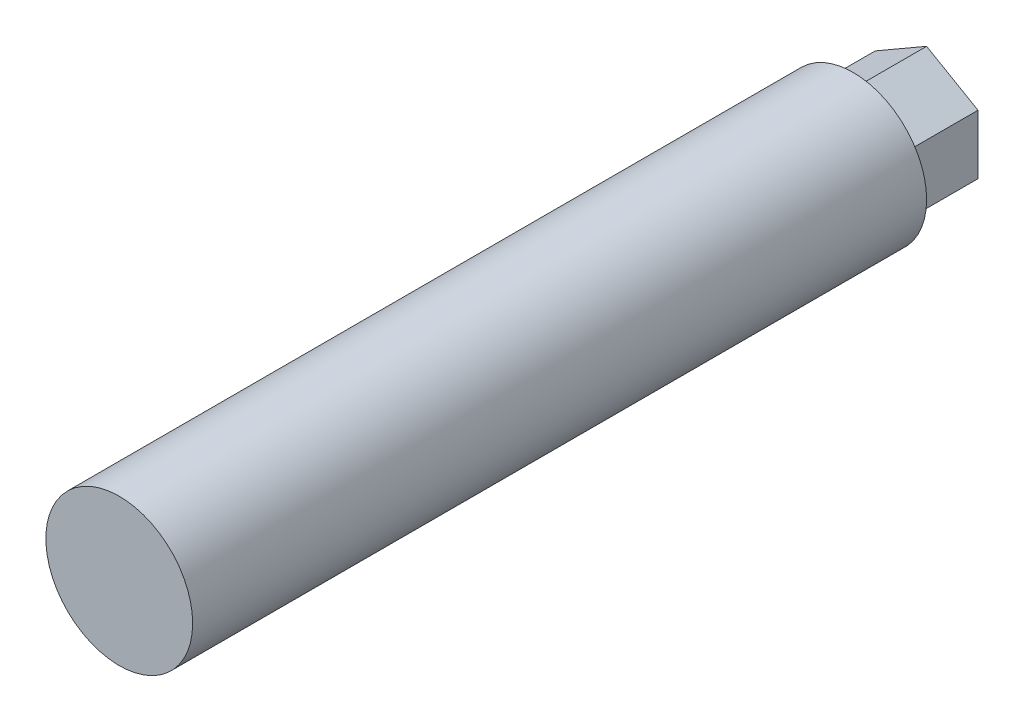
from build123d import *

# Parameters (mm, degrees)
SKETCH1_R           = 5
BOSS_EXTRUDE1_DEPTH = 50
BOSS_EXTRUDE2_DEPTH = 5


with BuildPart() as part:
    # Sketch1 → Boss-Extrude1 (new body)
    with BuildSketch(Plane.XY):
        Circle(SKETCH1_R)
    extrude(amount=BOSS_EXTRUDE1_DEPTH)

    # Sketch2 → Boss-Extrude2 (add)
    with BuildSketch(Plane(origin=(0, 0, 0), x_dir=(-1, 0, 0), z_dir=(0, 0, -1))):
        Polygon((0, 4.041451884), (-3.5, 2.020725942), (-3.5, -2.020725942), (0, -4.041451884), (3.5, -2.020725942), (3.5, 2.020725942), align=None)
    extrude(amount=BOSS_EXTRUDE2_DEPTH)


solid = part.part
